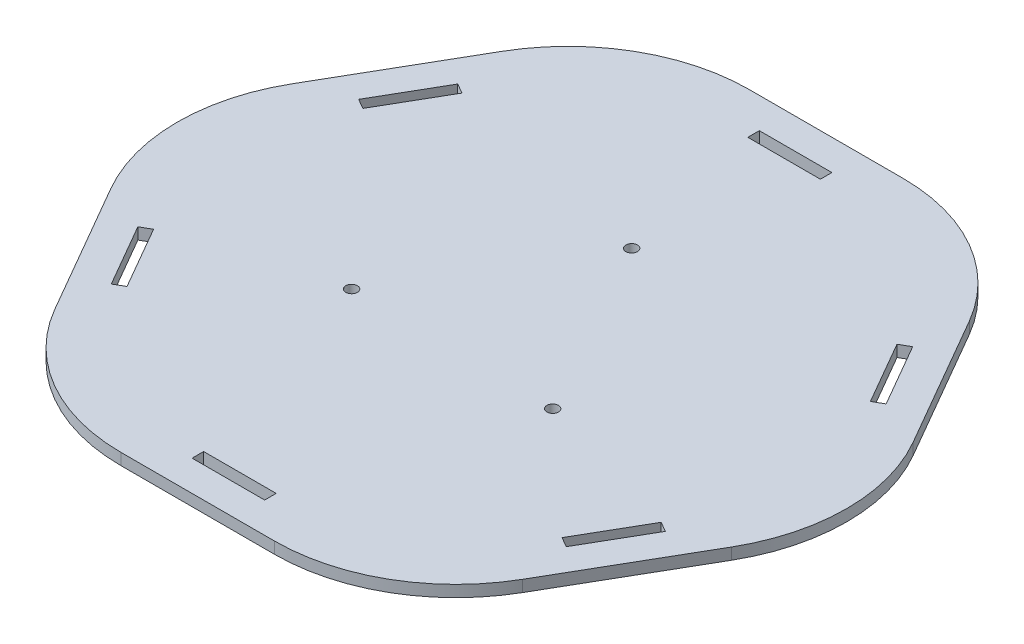
from build123d import *

# Parameters (mm, degrees)
SKETCH1_W           = 40
SKETCH1_H           = 6.35
BOSS_EXTRUDE1_DEPTH = 6.35
SKETCH2_R           = 3.2
CUT_EXTRUDE1_DEPTH  = 6.35


with BuildPart() as part:
    # Sketch1 → Boss-Extrude1 (new body)
    with BuildSketch(Plane(origin=(0, 0, 0), x_dir=(1, 0, 0), z_dir=(0, 1, 0))):
        with BuildLine():
            Line((171.132486541, 50), (128.867513459, 123.205080757))
            ThreePointArc((128.867513459, 123.205080757), (92.264973081, 159.807621135), (42.264973081, 173.205080757))
            Line((42.264973081, 173.205080757), (-42.264973081, 173.205080757))
            ThreePointArc((-42.264973081, 173.205080757), (-92.264973081, 159.807621135), (-128.867513459, 123.205080757))
            Line((-128.867513459, 123.205080757), (-171.132486541, 50))
            ThreePointArc((-171.132486541, 50), (-184.529946162, 0), (-171.132486541, -50))
            Line((-171.132486541, -50), (-128.867513459, -123.205080757))
            ThreePointArc((-128.867513459, -123.205080757), (-92.264973081, -159.807621135), (-42.264973081, -173.205080757))
            Line((-42.264973081, -173.205080757), (42.264973081, -173.205080757))
            ThreePointArc((42.264973081, -173.205080757), (92.264973081, -159.807621135), (128.867513459, -123.205080757))
            Line((128.867513459, -123.205080757), (171.132486541, -50))
            ThreePointArc((171.132486541, -50), (184.529946162, 0), (171.132486541, 50))
        make_face()
        with Locations((0, -153.175)):
            Rectangle(SKETCH1_W, SKETCH1_H, mode=Mode.SUBTRACT)
        Polygon((-139.903810568, -57.679491924), (-145.403071882, -60.854491924), (-125.403071882, -95.495508076), (-119.903810568, -92.320508076), align=None, mode=Mode.SUBTRACT)
        Polygon((-119.903810568, 92.320508076), (-125.403071882, 95.495508076), (-145.403071882, 60.854491924), (-139.903810568, 57.679491924), align=None, mode=Mode.SUBTRACT)
        with Locations((0, 153.175)):
            Rectangle(SKETCH1_W, SKETCH1_H, mode=Mode.SUBTRACT)
        Polygon((139.903810568, 57.679491924), (145.403071882, 60.854491924), (125.403071882, 95.495508076), (119.903810568, 92.320508076), align=None, mode=Mode.SUBTRACT)
        Polygon((119.903810568, -92.320508076), (125.403071882, -95.495508076), (145.403071882, -60.854491924), (139.903810568, -57.679491924), align=None, mode=Mode.SUBTRACT)
    extrude(amount=BOSS_EXTRUDE1_DEPTH)

    # Sketch2 → Cut-Extrude1 (cut)
    with BuildSketch(Plane(origin=(0, 6.35, 0), x_dir=(1, 0, 0), z_dir=(0, 1, 0))):
        with Locations(Location((55.794244464, -33.346698257, 0), (0, 0, 270))):
            Circle(SKETCH2_R)
        with Locations(Location((-56.776210055, -31.645883963, 0), (0, 0, 270))):
            Circle(SKETCH2_R)
        with Locations(Location((0.981965591, 64.99258222, 0), (0, 0, 270))):
            Circle(SKETCH2_R)
    extrude(amount=-CUT_EXTRUDE1_DEPTH, mode=Mode.SUBTRACT)


solid = part.part
